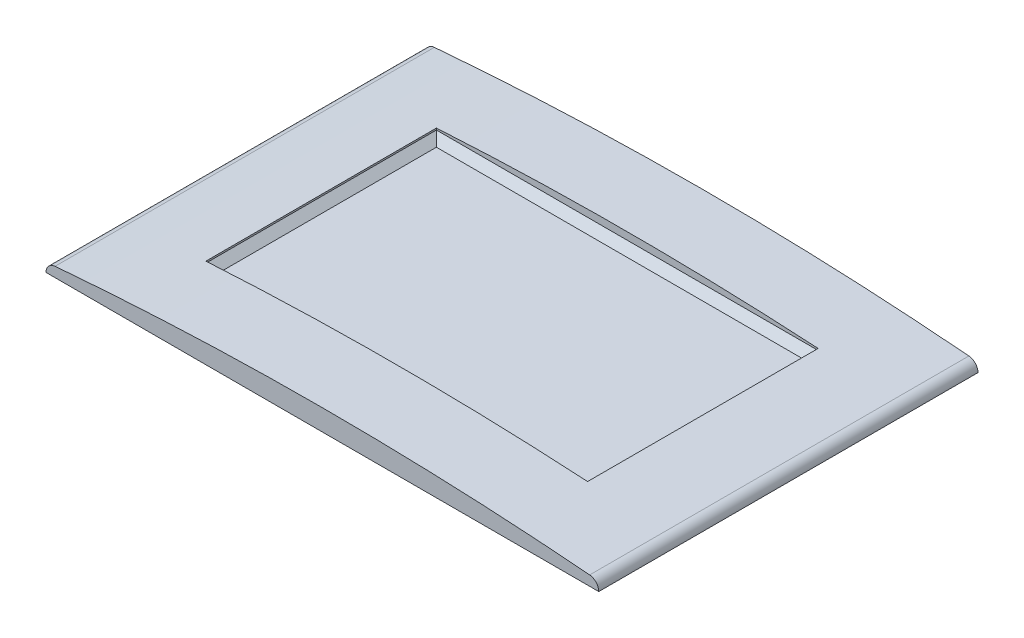
from build123d import *

# Parameters (mm, degrees)
SKETCH1_W                      = 223
SKETCH1_H                      = 153
BOSS_EXTRUDE2_DEPTH            = 8.5
SKETCH3_W                      = 154
SKETCH3_H                      = 93
CUT_EXTRUDE1_DEPTH             = 6
CUT_EXTRUDE3_REACH             = 137.487
CUT_EXTRUDE3_DIRECTION_2_REACH = 137.487
CHAMFER2_SIZE                  = 3


with BuildPart() as part:
    # Sketch1 → Boss-Extrude2 (new body)
    with BuildSketch(Plane(origin=(0, 0, 0), x_dir=(1, 0, 0), z_dir=(0, 1, 0))):
        Rectangle(SKETCH1_W, SKETCH1_H)
    extrude(amount=BOSS_EXTRUDE2_DEPTH)

    # Sketch3 → Cut-Extrude1 (cut)
    with BuildSketch(Plane(origin=(0, 8.5, 0), x_dir=(1, 0, 0), z_dir=(0, 1, 0))):
        Rectangle(SKETCH3_W, SKETCH3_H)
    extrude(amount=-CUT_EXTRUDE1_DEPTH, mode=Mode.SUBTRACT)

    # Cut-Extrude3: up to this face of the body (flat: up to its plane)
    cut_extrude3_end = Plane(part.part.faces().sort_by_distance((0, 4.25, -76.5))[0])
    # Sketch4 → Cut-Extrude3 (cut, up to the picked face)
    with BuildSketch(Plane.XY, mode=Mode.PRIVATE) as cut_extrude3_sk1:
        with BuildLine():
            Line((0, 8.5), (-111.5, 8.5))
            Line((-111.5, 8.5), (-111.5, 0))
            ThreePointArc((-111.5, 0), (-110.444247928, 2.707656577), (-107.834297931, 3.986006133))
            ThreePointArc((-107.834297931, 3.986006133), (-53.96436776, 7.371007599), (0, 8.5))
        make_face()
    cut_extrude3_tool1 = split(extrude(cut_extrude3_sk1.sketch, amount=-CUT_EXTRUDE3_REACH, mode=Mode.PRIVATE), bisect_by=cut_extrude3_end, keep=Keep.BOTH, mode=Mode.PRIVATE)
    # Sketch4 → Cut-Extrude3 (cut, up to the picked face)
    with BuildSketch(Plane.XY, mode=Mode.PRIVATE) as cut_extrude3_sk2:
        with BuildLine():
            Line((111.5, 8.5), (0, 8.5))
            ThreePointArc((0, 8.5), (53.96436776, 7.371007599), (107.834297931, 3.986006133))
            ThreePointArc((107.834297931, 3.986006133), (110.444247928, 2.707656577), (111.5, 0))
            Line((111.5, 0), (111.5, 8.5))
        make_face()
    cut_extrude3_tool2 = split(extrude(cut_extrude3_sk2.sketch, amount=-CUT_EXTRUDE3_REACH, mode=Mode.PRIVATE), bisect_by=cut_extrude3_end, keep=Keep.BOTH, mode=Mode.PRIVATE)
    add(cut_extrude3_tool1.solids().sort_by(Axis((-84.053137, 6.988854, 0), (0, 0, -1)))[0], mode=Mode.SUBTRACT)
    add(cut_extrude3_tool2.solids().sort_by(Axis((84.053137, 6.988854, 0), (0, 0, -1)))[0], mode=Mode.SUBTRACT)

    # Cut-Extrude3 direction 2: up to this face of the body (flat: up to its plane)
    cut_extrude3_direction_2_end = Plane(part.part.faces().sort_by_distance((0, 4.25, 76.5))[0])
    # Sketch4 → Cut-Extrude3 direction 2 (cut, up to the picked face)
    with BuildSketch(Plane.XY, mode=Mode.PRIVATE) as cut_extrude3_direction_2_sk1:
        with BuildLine():
            Line((0, 8.5), (-111.5, 8.5))
            Line((-111.5, 8.5), (-111.5, 0))
            ThreePointArc((-111.5, 0), (-110.444247928, 2.707656577), (-107.834297931, 3.986006133))
            ThreePointArc((-107.834297931, 3.986006133), (-53.96436776, 7.371007599), (0, 8.5))
        make_face()
    cut_extrude3_direction_2_tool1 = split(extrude(cut_extrude3_direction_2_sk1.sketch, amount=CUT_EXTRUDE3_DIRECTION_2_REACH, mode=Mode.PRIVATE), bisect_by=cut_extrude3_direction_2_end, keep=Keep.BOTH, mode=Mode.PRIVATE)
    # Sketch4 → Cut-Extrude3 direction 2 (cut, up to the picked face)
    with BuildSketch(Plane.XY, mode=Mode.PRIVATE) as cut_extrude3_direction_2_sk2:
        with BuildLine():
            Line((111.5, 8.5), (0, 8.5))
            ThreePointArc((0, 8.5), (53.96436776, 7.371007599), (107.834297931, 3.986006133))
            ThreePointArc((107.834297931, 3.986006133), (110.444247928, 2.707656577), (111.5, 0))
            Line((111.5, 0), (111.5, 8.5))
        make_face()
    cut_extrude3_direction_2_tool2 = split(extrude(cut_extrude3_direction_2_sk2.sketch, amount=CUT_EXTRUDE3_DIRECTION_2_REACH, mode=Mode.PRIVATE), bisect_by=cut_extrude3_direction_2_end, keep=Keep.BOTH, mode=Mode.PRIVATE)
    add(cut_extrude3_direction_2_tool1.solids().sort_by(Axis((-84.053137, 6.988854, 0), (0, 0, 1)))[0], mode=Mode.SUBTRACT)
    add(cut_extrude3_direction_2_tool2.solids().sort_by(Axis((84.053137, 6.988854, 0), (0, 0, 1)))[0], mode=Mode.SUBTRACT)

    # Chamfer2
    chamfer2_edges = [part.edges().sort_by_distance(p)[0] for p in [
        (77, 2.5, 0),
        (0, 2.5, 46.5),
        (-77, 2.5, 0),
        (0, 2.5, -46.5),
    ]]
    chamfer(chamfer2_edges, length=CHAMFER2_SIZE)


solid = part.part
